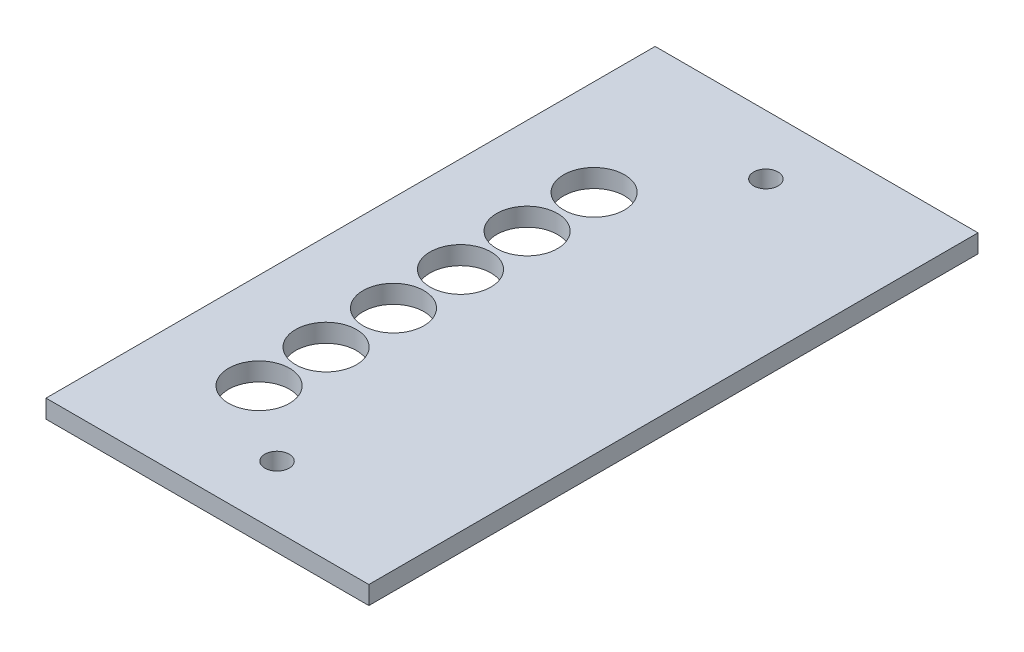
from build123d import *

# Parameters (mm, degrees)
ESBO_O2_W                = 53
ESBO_O2_H                = 100
RESSALTO_EXTRUS_O1_DEPTH = 3
ESBO_O14_R               = 2
CORTE_EXTRUS_O10_DEPTH   = 10
ESBO_O8_R                = 5
CORTE_EXTRUS_O11_DEPTH   = 10
ESBO_O4_R                = 2
CORTE_EXTRUS_O12_DEPTH   = 10


with BuildPart() as part:
    # Esboço2 → Ressalto-extrusão1 (new body)
    with BuildSketch(Plane(origin=(-2.802903092, 0, -5.758743908), x_dir=(1, 0, 0), z_dir=(0, 1, 0))):
        with Locations((-26.430669922, 50)):
            Rectangle(ESBO_O2_W, ESBO_O2_H)
    extrude(amount=RESSALTO_EXTRUS_O1_DEPTH)

    # Esboço14 → Corte-extrusão10 (cut)
    with BuildSketch(Plane(origin=(0, 3, 0), x_dir=(1, 0, 0), z_dir=(0, 1, 0))):
        with Locations(Location((-27.802903092, 15.758743908, 0), (0, 0, 270))):
            Circle(ESBO_O14_R)
    extrude(amount=-CORTE_EXTRUS_O10_DEPTH, mode=Mode.SUBTRACT)

    # Esboço8 → Corte-extrusão11 (cut)
    with BuildSketch(Plane(origin=(0, 3, 0), x_dir=(1, 0, 0), z_dir=(0, 1, 0))):
        with Locations(Location((-40, 25, 0), (0, 0, 270))):
            Circle(ESBO_O8_R)
        with Locations(Location((-40, 36, 0), (0, 0, 270))):
            Circle(ESBO_O8_R)
        with Locations(Location((-40, 47.07, 0), (0, 0, 270))):
            Circle(ESBO_O8_R)
        with Locations(Location((-40, 58.07, 0), (0, 0, 270))):
            Circle(ESBO_O8_R)
        with Locations(Location((-40, 69, 0), (0, 0, 270))):
            Circle(ESBO_O8_R)
        with Locations(Location((-40, 80, 0), (0, 0, 270))):
            Circle(ESBO_O8_R)
    extrude(amount=-CORTE_EXTRUS_O11_DEPTH, mode=Mode.SUBTRACT)

    # Esboço4 → Corte-extrusão12 (cut)
    with BuildSketch(Plane(origin=(0, 3, 0), x_dir=(1, 0, 0), z_dir=(0, 1, 0))):
        with Locations(Location((-27.802903092, 96, 0), (0, 0, 270))):
            Circle(ESBO_O4_R)
    extrude(amount=-CORTE_EXTRUS_O12_DEPTH, mode=Mode.SUBTRACT)


solid = part.part
